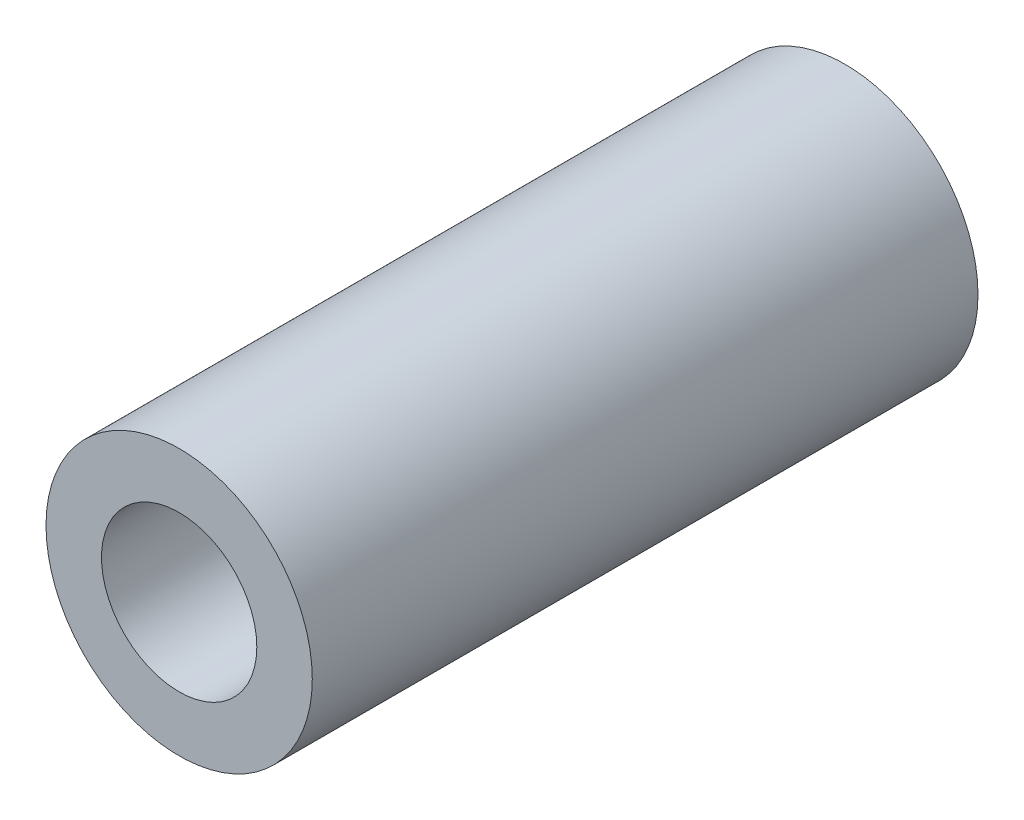
from build123d import *

# Parameters (mm, degrees)
SKETCH1_R           = 3
SKETCH1_R_2         = 1.75
BOSS_EXTRUDE1_DEPTH = 15


with BuildPart() as part:
    # Sketch1 → Boss-Extrude1 (new body)
    with BuildSketch(Plane.XY):
        Circle(SKETCH1_R)
        Circle(SKETCH1_R_2, mode=Mode.SUBTRACT)
    extrude(amount=BOSS_EXTRUDE1_DEPTH)


solid = part.part
